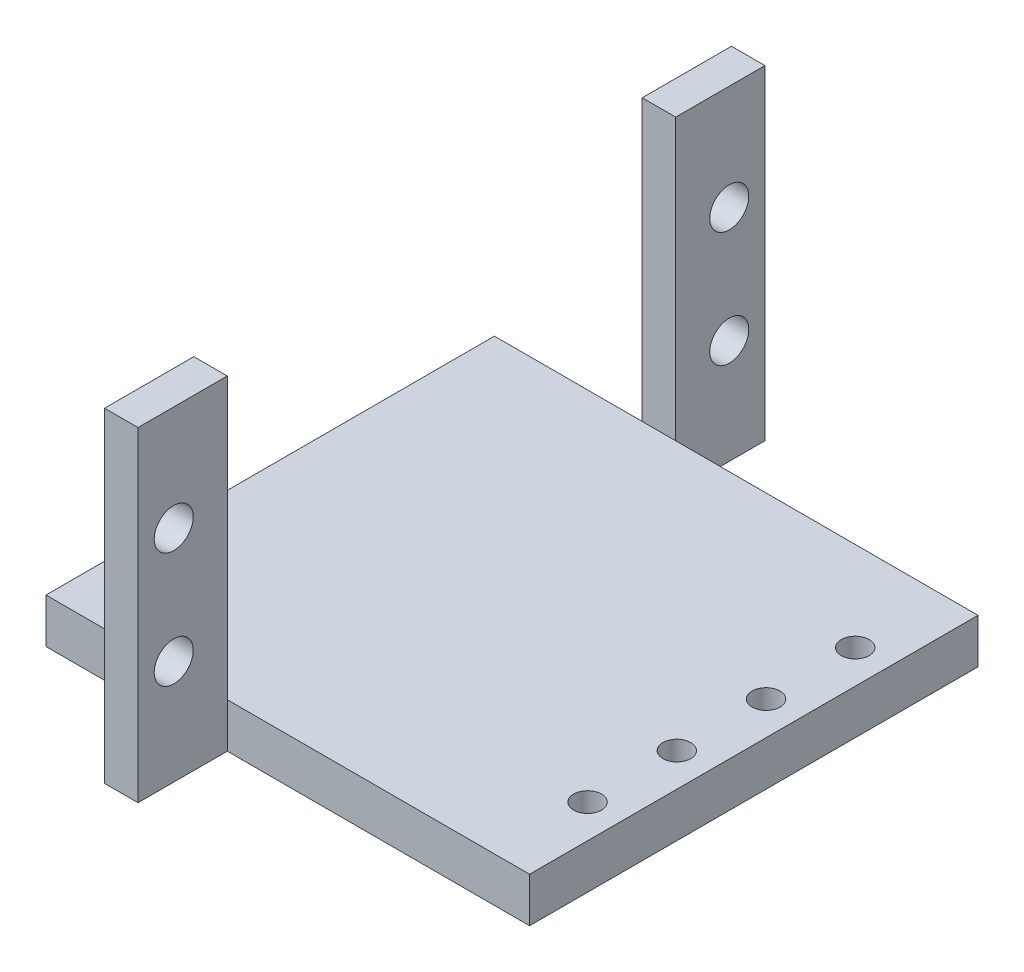
from build123d import *

# Parameters (mm, degrees)
BOSS_EXTRUDE2_DEPTH = 4
SKETCH24_W          = 3
SKETCH24_H          = 8
BOSS_EXTRUDE3_DEPTH = 25.13
SKETCH25_R          = 1.75
SKETCH25_R_2        = 1.750000009
CUT_EXTRUDE1_DEPTH  = 4
SKETCH26_W          = 40.2
SKETCH26_H          = 4
BOSS_EXTRUDE4_DEPTH = 0.65
SKETCH27_R          = 1.25
CUT_EXTRUDE2_DEPTH  = 5


with BuildPart() as part:
    # Sketch23 → Boss-Extrude2 (new body)
    with BuildSketch(Plane(origin=(0, 0, 0), x_dir=(1, 0, 0), z_dir=(0, 1, 0))):
        Polygon((-77.074690926, 0), (-63.824690926, 0), (-63.824690926, -8), (-60.824690926, -8), (-60.824690926, 0), (-34.374690926, 0), (-34.374690926, 40.2), (-60.824690926, 40.2), (-60.824690926, 48.2), (-63.824690926, 48.2), (-63.824690926, 40.2), (-77.074690926, 40.2), align=None)
    extrude(amount=BOSS_EXTRUDE2_DEPTH)

    # Sketch24 → Boss-Extrude3 (add)
    with BuildSketch(Plane(origin=(0, 4, 0), x_dir=(1, 0, 0), z_dir=(0, 1, 0))):
        with Locations((-62.324690926, -4)):
            Rectangle(SKETCH24_W, SKETCH24_H)
        with Locations((-62.324690926, 44.2)):
            Rectangle(SKETCH24_W, SKETCH24_H)
    extrude(amount=BOSS_EXTRUDE3_DEPTH)

    # Sketch25 → Cut-Extrude1 (cut)
    with BuildSketch(Plane.ZY.offset(63.824690926)):
        with Locations((4.799999987, 9.375)):
            Circle(SKETCH25_R)
        with Locations((-45, 9.375)):
            Circle(SKETCH25_R)
        with Locations((-45, 19.725)):
            Circle(SKETCH25_R)
        with Locations((4.799999987, 19.725)):
            Circle(SKETCH25_R_2)
    extrude(amount=-CUT_EXTRUDE1_DEPTH, mode=Mode.SUBTRACT)

    # Sketch26 → Boss-Extrude4 (add)
    with BuildSketch(Plane(origin=(-34.374690926, 0, 0), x_dir=(0, 0, -1), z_dir=(1, 0, 0))):
        with Locations((20.1, 2)):
            Rectangle(SKETCH26_W, SKETCH26_H)
    extrude(amount=BOSS_EXTRUDE4_DEPTH)

    # Sketch27 → Cut-Extrude2 (cut)
    with BuildSketch(Plane(origin=(0, 4, 0), x_dir=(1, 0, 0), z_dir=(0, 1, 0))):
        with Locations(Location((-36.724690926, 32.192020694, 0), (0, 0, 270))):
            Circle(SKETCH27_R)
        with Locations(Location((-36.724690926, 24.2, 0), (0, 0, 270))):
            Circle(SKETCH27_R)
        with Locations(Location((-36.724690926, 16.2, 0), (0, 0, 270))):
            Circle(SKETCH27_R)
        with Locations(Location((-36.724690926, 8.2, 0), (0, 0, 270))):
            Circle(SKETCH27_R)
    extrude(amount=-CUT_EXTRUDE2_DEPTH, mode=Mode.SUBTRACT)


solid = part.part
